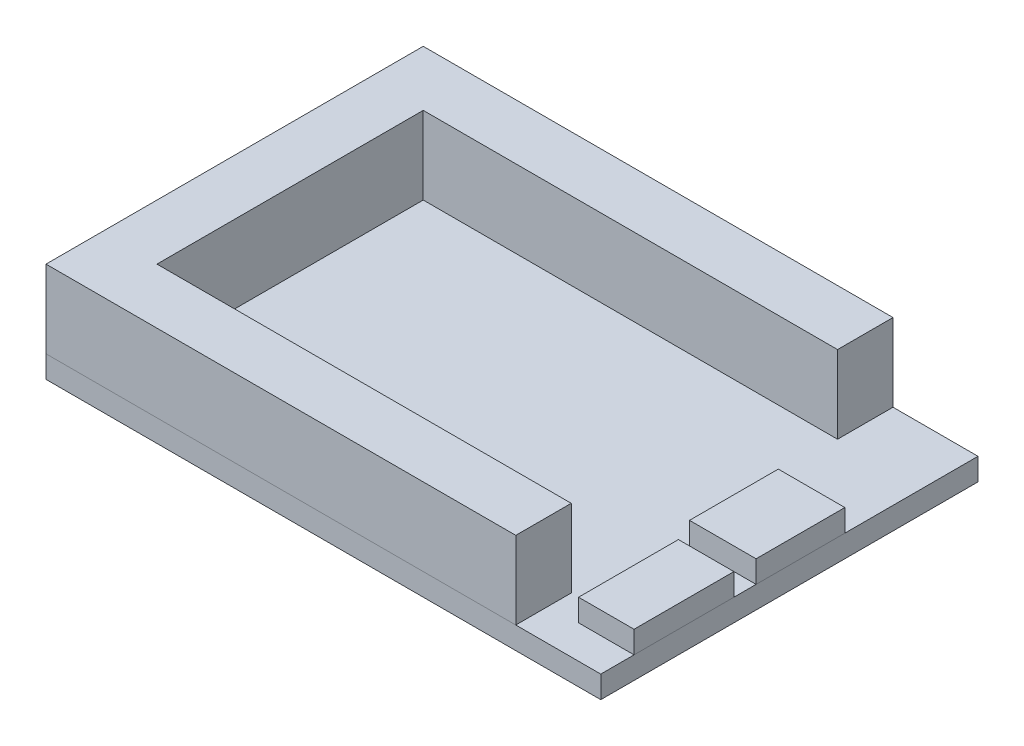
from build123d import *

# Parameters (mm, degrees)
SKETCH_1_W        = 50
SKETCH_1_H        = 34
EXTRUDE_1_DEPTH   = 2
SKETCH_2_W        = 6
SKETCH_2_H        = 8
EXTRUDE_2_DEPTH   = 2
SKETCH_2_W_2      = 5
SKETCH_2_H_2      = 9
EXTRUDE_2_2_DEPTH = 2
EXTRUDE_3_DEPTH   = 7


with BuildPart() as part:
    # 草图1 → 凸台-拉伸1 (new body)
    with BuildSketch(Plane(origin=(0, 0, 0), x_dir=(1, 0, 0), z_dir=(0, 1, 0))):
        Rectangle(SKETCH_1_W, SKETCH_1_H)
    extrude(amount=EXTRUDE_1_DEPTH)


with BuildPart() as body_2:
    # 草图2 → 凸台-拉伸2 (new body)
    with BuildSketch(Plane(origin=(0, 2, 0), x_dir=(1, 0, 0), z_dir=(0, 1, 0))):
        with Locations((22, 1)):
            Rectangle(SKETCH_2_W, SKETCH_2_H)
    extrude(amount=EXTRUDE_2_DEPTH)


with BuildPart() as body_3:
    # 草图2 → Extrude 2 2 (new body)
    with BuildSketch(Plane(origin=(0, 2, 0), x_dir=(1, 0, 0), z_dir=(0, 1, 0))):
        with Locations((22.5, -9.5)):
            Rectangle(SKETCH_2_W_2, SKETCH_2_H_2)
    extrude(amount=EXTRUDE_2_2_DEPTH)


with BuildPart() as body_4:
    # 草图3 → 凸台-拉伸3 (new body)
    with BuildSketch(Plane(origin=(0, 2, 0), x_dir=(1, 0, 0), z_dir=(0, 1, 0))):
        Polygon((17.340449086, 12), (-20, 12), (-20, -12), (17.340449086, -12), (17.340449086, -17), (-25, -17), (-25, 17), (17.340449086, 17), align=None)
    extrude(amount=EXTRUDE_3_DEPTH)


solid = Compound([part.part, body_2.part, body_3.part, body_4.part])
